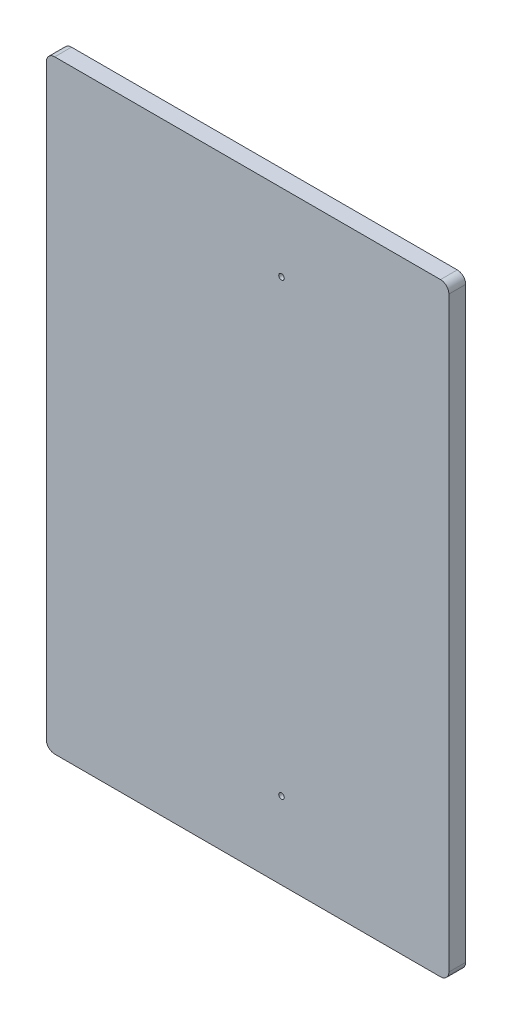
from build123d import *

# Parameters (mm, degrees)
SKETCH2_W           = 304.8
SKETCH2_H           = 457.2
BOSS_EXTRUDE1_DEPTH = 12.7
FILLET1_R           = 6.35
SKETCH4_R           = 2.0955
CUT_EXTRUDE1_DEPTH  = 465.071624321


with BuildPart() as part:
    # Sketch2 → Boss-Extrude1 (new body)
    with BuildSketch(Plane.XY):
        with Locations((0, -209.55)):
            Rectangle(SKETCH2_W, SKETCH2_H)
    extrude(amount=BOSS_EXTRUDE1_DEPTH)

    # Fillet1
    fillet1_edges = [part.edges().sort_by_distance(p)[0] for p in [
        (152.4, -438.15, 6.35),
        (-152.4, -438.15, 6.35),
        (-152.4, 19.05, 6.35),
        (152.4, 19.05, 6.35),
    ]]
    fillet(fillet1_edges, radius=FILLET1_R)

    # Sketch4 → Cut-Extrude1 (cut, through all)
    with BuildSketch(Plane(origin=(0, 0, 0), x_dir=(-1, 0, 0), z_dir=(0, 0, -1))):
        with Locations((-25.654, -39.37)):
            Circle(SKETCH4_R)
        with Locations(Location((-25.654, -379.73, 0), (0, 0, 180))):
            Circle(SKETCH4_R)
    extrude(amount=-CUT_EXTRUDE1_DEPTH, mode=Mode.SUBTRACT)


solid = part.part
